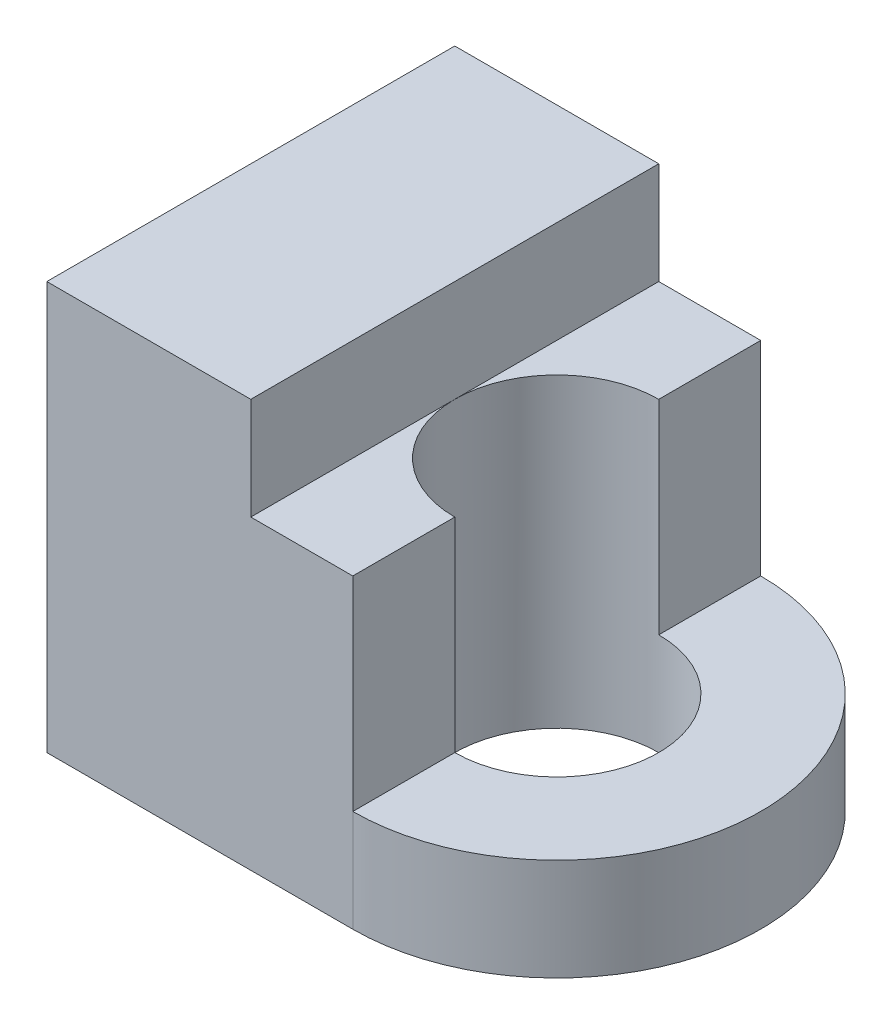
from build123d import *

# Parameters (mm, degrees)
SKETCH1_R           = 10
BOSS_EXTRUDE1_DEPTH = 40
SKETCH2_OUTSIDE_W   = 67.1
SKETCH2_OUTSIDE_H   = 57.1
SKETCH2_OUTSIDE_W_2 = 20
SKETCH2_OUTSIDE_H_2 = 40
CUT_EXTRUDE1_DEPTH  = 10
SKETCH3_W           = 22.643169196
SKETCH3_H           = 40
CUT_EXTRUDE2_DEPTH  = 20


with BuildPart() as part:
    # Sketch1 → Boss-Extrude1 (new body)
    with BuildSketch(Plane(origin=(0, 0, 0), x_dir=(1, 0, 0), z_dir=(0, 1, 0))):
        with BuildLine():
            Line((0, 20), (-30, 20))
            Line((-30, 20), (-30, -20))
            Line((-30, -20), (0, -20))
            ThreePointArc((0, -20), (20, 0), (0, 20))
        make_face()
        with Locations(Location((0, 0, 0), (0, 0, 270))):
            Circle(SKETCH1_R, mode=Mode.SUBTRACT)
    extrude(amount=BOSS_EXTRUDE1_DEPTH)

    # Sketch2 outside → Cut-Extrude1 (cut)
    with BuildSketch(Plane(origin=(0, 40, 0), x_dir=(1, 0, 0), z_dir=(0, 1, 0))):
        with Locations((-5, 0)):
            Rectangle(SKETCH2_OUTSIDE_W, SKETCH2_OUTSIDE_H)
        with Locations((-20, 0)):
            Rectangle(SKETCH2_OUTSIDE_W_2, SKETCH2_OUTSIDE_H_2, mode=Mode.SUBTRACT)
    extrude(amount=-CUT_EXTRUDE1_DEPTH, mode=Mode.SUBTRACT)

    # Sketch3 → Cut-Extrude2 (cut)
    with BuildSketch(Plane(origin=(0, 30, 0), x_dir=(1, 0, 0), z_dir=(0, 1, 0))):
        with Locations((11.321584598, 0)):
            Rectangle(SKETCH3_W, SKETCH3_H)
    extrude(amount=-CUT_EXTRUDE2_DEPTH, mode=Mode.SUBTRACT)


solid = part.part
